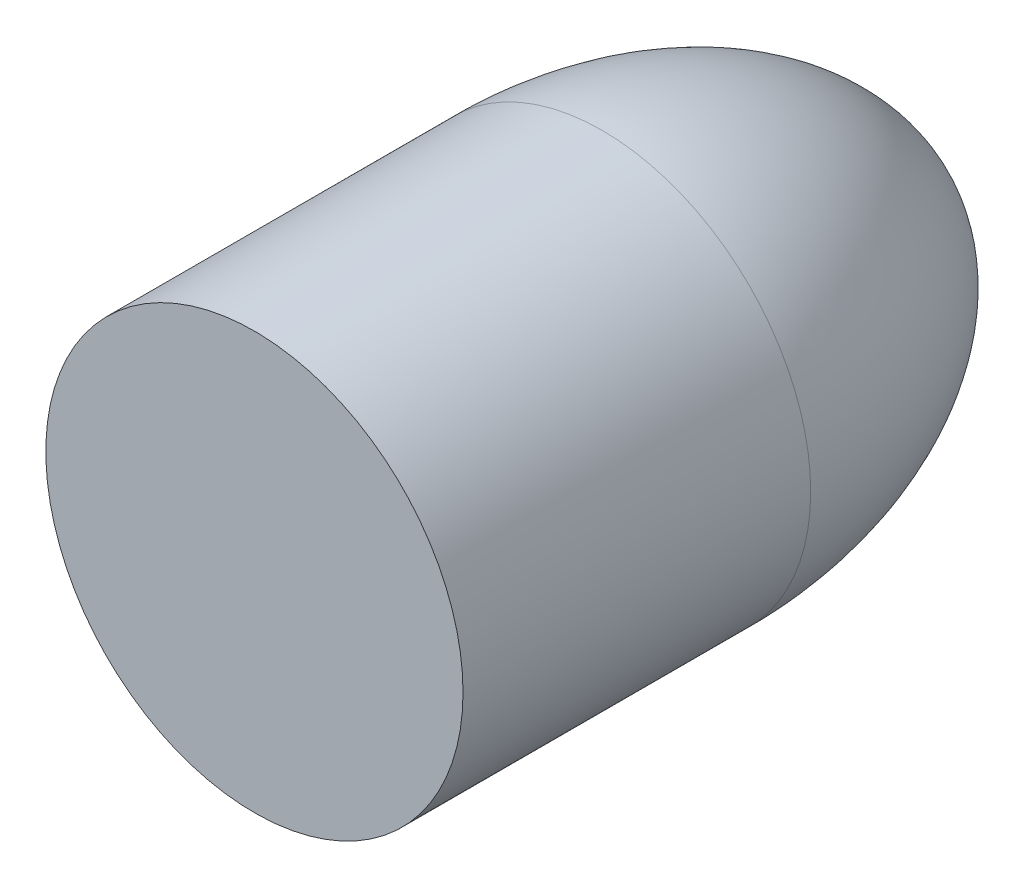
from build123d import *

# Parameters (mm, degrees)
SKETCH2_R           = 76.2
BOSS_EXTRUDE1_DEPTH = 127


with BuildPart() as part:
    # Sketch1 → Revolve1 (revolve)
    with BuildSketch(Plane(origin=(0, 0, 0), x_dir=(0, 0, -1), z_dir=(1, 0, 0))):
        with BuildLine():
            Line((0, 76.2), (0, 0))
            Line((0, 0), (114.3, 0))
            add(Edge.make_bspline(
                [(0, 76.2), (0.264306544, 76.2), (0.793671564, 76.198742744), (1.665362569, 76.193085097), (2.846363042, 76.177997126), (4.273406908, 76.149704328), (5.963814226, 76.100654953), (7.96057394, 76.021396761), (10.228614301, 75.900554127), (12.49946031, 75.749391059), (14.76623457, 75.567834167), (17.597302169, 75.302785515), (20.988019265, 74.923556588), (24.93324811, 74.391398458), (29.423444168, 73.658976501), (33.891424636, 72.800873309), (38.333028517, 71.815393587), (43.846750219, 70.421878606), (50.392551994, 68.486550655), (57.904231208, 65.834058821), (66.268893732, 62.237121603), (74.19020305, 58.130870572), (80.806018035, 54.027697556), (86.192132846, 50.137057922), (90.450635874, 46.649466871), (93.822075919, 43.592468939), (97.025300347, 40.359237584), (100.039148354, 36.948391332), (102.840224578, 33.360277693), (105.402899199, 29.597738142), (107.699766519, 25.666795898), (109.702256705, 21.57742523), (111.381650727, 17.344573823), (112.800694333, 12.693115176), (113.809196713, 7.804640574), (114.210195468, 3.972044716), (114.299994138, 1.263302191), (114.3, 0)],
                knots=[0.070366239, 0.070366239, 0.070366239, 0.070366239, 0.070366239, 0.077362256, 0.084358273, 0.09135429, 0.098350306, 0.11234234, 0.126334374, 0.140326408, 0.154318443, 0.168310478, 0.182302512, 0.210286579, 0.238270646, 0.266254712, 0.294238779, 0.322222846, 0.350206914, 0.406175046, 0.462143183, 0.518111324, 0.57407942, 0.625518451, 0.653502428, 0.681486487, 0.709470444, 0.73745448, 0.765438592, 0.793422267, 0.821406587, 0.849389702, 0.877373471, 0.905358549, 0.933343634, 0.968915589, 1, 1, 1, 1, 1], degree=4))
        make_face()
    revolve(axis=Axis((0, 0, -480.06), (0, 0, 1)))

    # Sketch2 → Boss-Extrude1 (add)
    with BuildSketch(Plane.XY):
        Circle(SKETCH2_R)
    extrude(amount=BOSS_EXTRUDE1_DEPTH)


solid = part.part
